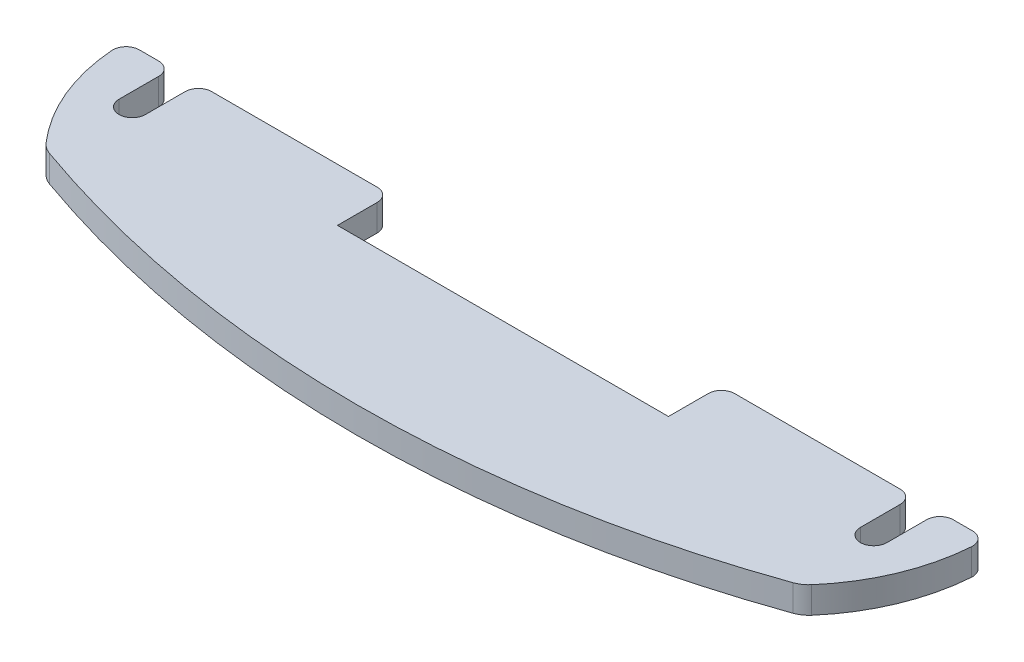
from build123d import *

# Parameters (mm, degrees)
RESSALTO_EXTRUS_O1_DEPTH = 2


with BuildPart() as part:
    # Esboço1 → Ressalto-extrusão1 (new body)
    with BuildSketch(Plane(origin=(0, 0, 0), x_dir=(1, 0, 0), z_dir=(0, 1, 0))):
        with BuildLine():
            Line((-12.5, 0), (12.5, 0))
            Line((12.5, 0), (12.5, 3))
            ThreePointArc((12.5, 3), (12.792893219, 3.707106781), (13.5, 4))
            Line((13.5, 4), (26, 4))
            ThreePointArc((26, 4), (26.707106781, 3.707106781), (27, 3))
            Line((27, 3), (27, 0))
            ThreePointArc((27, 0), (28, -1), (29, 0))
            Line((29, 0), (29, 3))
            ThreePointArc((29, 3), (29.292893219, 3.707106781), (30, 4))
            Line((30, 4), (31.463239539, 4))
            ThreePointArc((31.463239539, 4), (32.195845062, 3.680653471), (32.460540524, 2.926578296))
            ThreePointArc((32.460540524, 2.926578296), (31.37483832, -1.624378023), (28.907100926, -5.599327689))
            ThreePointArc((28.907100926, -5.599327689), (28.523980806, -5.93948611), (28.067011203, -6.171148708))
            ThreePointArc((28.067011203, -6.171148708), (14.239688573, -9.783983548), (0, -11))
            ThreePointArc((0, -11), (-14.239688573, -9.783983548), (-28.067011203, -6.171148708))
            ThreePointArc((-28.067011203, -6.171148708), (-28.523980806, -5.93948611), (-28.907100926, -5.599327689))
            ThreePointArc((-28.907100926, -5.599327689), (-31.37483832, -1.624378023), (-32.460540524, 2.926578296))
            ThreePointArc((-32.460540524, 2.926578296), (-32.195845062, 3.680653471), (-31.463239539, 4))
            Line((-31.463239539, 4), (-30, 4))
            ThreePointArc((-30, 4), (-29.292893219, 3.707106781), (-29, 3))
            Line((-29, 3), (-29, 0))
            ThreePointArc((-29, 0), (-28, -1), (-27, 0))
            Line((-27, 0), (-27, 3))
            ThreePointArc((-27, 3), (-26.707106781, 3.707106781), (-26, 4))
            Line((-26, 4), (-13.5, 4))
            ThreePointArc((-13.5, 4), (-12.792893219, 3.707106781), (-12.5, 3))
            Line((-12.5, 3), (-12.5, 0))
        make_face()
    extrude(amount=RESSALTO_EXTRUS_O1_DEPTH)


solid = part.part
